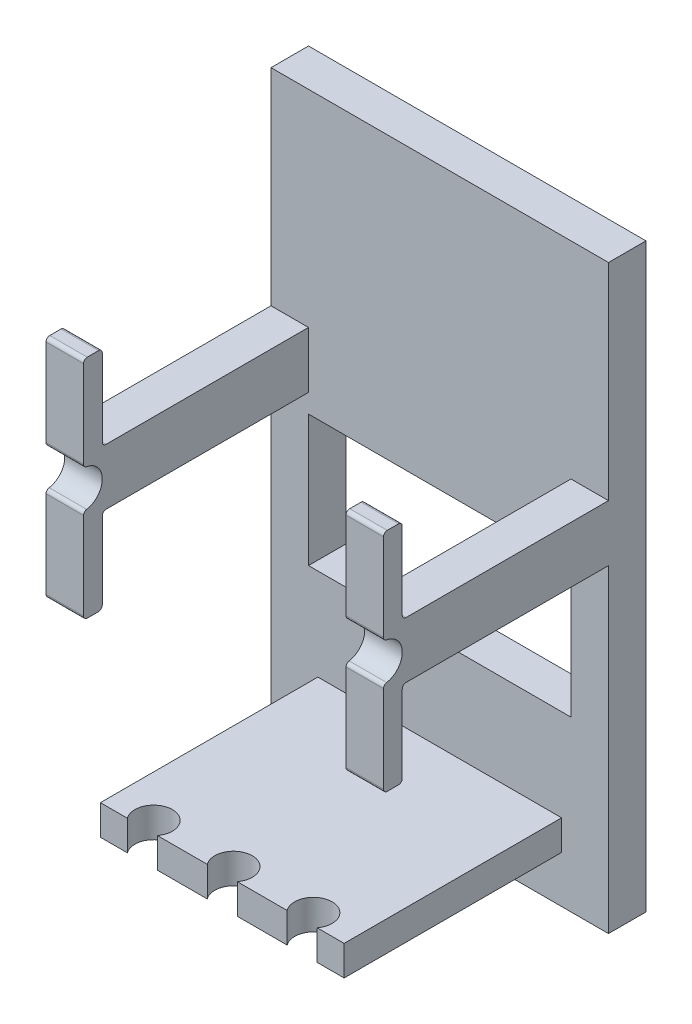
from build123d import *

# Parameters (mm, degrees)
SKETCH1_W               = 125
SKETCH1_H               = 90
BOSS_EXTRUDE1_DEPTH     = 10
BOSS_EXTRUDE2_DEPTH     = 35
BOSS_EXTRUDE3_DEPTH     = 45
SKETCH11_W              = 90
SKETCH11_H              = 30
BOSS_EXTRUDE5_DEPTH     = 10
CUT_EXTRUDE2_DEPTH      = 126
CUT_EXTRUDE2_DEPTH_BACK = 126
SKETCH7_W               = 35
SKETCH7_H               = 43
SKETCH7_H_2             = 6
SKETCH7_H_3             = 1
SKETCH17_W              = 60.575148418
SKETCH17_H              = 1.596164387
SKETCH17_W_2            = 94.424851582
BOSS_EXTRUDE7_DEPTH     = 90
SKETCH18_W              = 155
SKETCH18_H              = 8.403835613
BOSS_EXTRUDE8_DEPTH     = 90
CUT_EXTRUDE3_DEPTH      = 143.324453275
CUT_EXTRUDE3_DEPTH_BACK = 143.324453275
CUT_EXTRUDE4_DEPTH      = 126
CUT_EXTRUDE4_DEPTH_BACK = 126
SKETCH21_W              = 70
SKETCH21_H              = 10
CUT_EXTRUDE5_DEPTH      = 120.085053638
CUT_EXTRUDE5_DEPTH_BACK = 120.085053638
SKETCH22_W              = 70
SKETCH22_H              = 35
SKETCH23_W              = 65
SKETCH23_H              = 8
BOSS_EXTRUDE9_DEPTH     = 58
SKETCH24_R              = 5
CUT_EXTRUDE6_DEPTH      = 29


with BuildPart() as part:
    # Sketch1 → Boss-Extrude1 (new body)
    with BuildSketch(Plane(origin=(0, 0, 0), x_dir=(0, 1, 0), z_dir=(0, 0, 1))):
        Rectangle(SKETCH1_W, SKETCH1_H)
    extrude(amount=BOSS_EXTRUDE1_DEPTH)

    # Sketch3 → Boss-Extrude2 (add, symmetric)
    with BuildSketch(Plane.YZ):
        with BuildLine():
            Line((5.916079783, 60), (7.5, 60))
            Line((7.5, 60), (29.144025452, 60))
            ThreePointArc((29.144025452, 60), (29.851132233, 59.707106781), (30.144025452, 59))
            Line((30.144025452, 59), (30.144025452, 56))
            ThreePointArc((30.144025452, 56), (29.851132233, 55.292893219), (29.144025452, 55))
            Line((29.144025452, 55), (8.5, 55))
            ThreePointArc((8.5, 55), (7.792893219, 54.707106781), (7.5, 54))
            Line((7.5, 54), (7.5, 0))
            Line((7.5, 0), (-7.5, 0))
            Line((-7.5, 0), (-7.5, 54))
            ThreePointArc((-7.5, 54), (-7.792893219, 54.707106781), (-8.5, 55))
            Line((-8.5, 55), (-29.144025452, 55))
            ThreePointArc((-29.144025452, 55), (-29.851132233, 55.292893219), (-30.144025452, 56))
            Line((-30.144025452, 56), (-30.144025452, 59))
            ThreePointArc((-30.144025452, 59), (-29.851132233, 59.707106781), (-29.144025452, 60))
            Line((-29.144025452, 60), (-7.5, 60))
            Line((-7.5, 60), (-5.916079783, 60))
            ThreePointArc((-5.916079783, 60), (-5.270582559, 59.763762616), (-4.930066486, 59.166666667))
            ThreePointArc((-4.930066486, 59.166666667), (0, 55), (4.930066486, 59.166666667))
            ThreePointArc((4.930066486, 59.166666667), (5.270582559, 59.763762616), (5.916079783, 60))
        make_face()
    extrude(amount=BOSS_EXTRUDE2_DEPTH, both=True)

    # Sketch5 → Boss-Extrude3 (add, symmetric)
    with BuildSketch(Plane.YZ):
        with BuildLine():
            ThreePointArc((-7.5, 54), (-7.792893219, 54.707106781), (-8.5, 55))
            Line((-8.5, 55), (-29.144025452, 55))
            ThreePointArc((-29.144025452, 55), (-29.851132233, 55.292893219), (-30.144025452, 56))
            Line((-30.144025452, 56), (-30.144025452, 59))
            ThreePointArc((-30.144025452, 59), (-29.851132233, 59.707106781), (-29.144025452, 60))
            Line((-29.144025452, 60), (-5.916079783, 60))
            ThreePointArc((-5.916079783, 60), (-5.270582559, 59.763762616), (-4.930066486, 59.166666667))
            ThreePointArc((-4.930066486, 59.166666667), (0, 55), (4.930066486, 59.166666667))
            ThreePointArc((4.930066486, 59.166666667), (5.270582559, 59.763762616), (5.916079783, 60))
            Line((5.916079783, 60), (29.144025452, 60))
            ThreePointArc((29.144025452, 60), (29.851132233, 59.707106781), (30.144025452, 59))
            Line((30.144025452, 59), (30.144025452, 56))
            ThreePointArc((30.144025452, 56), (29.851132233, 55.292893219), (29.144025452, 55))
            Line((29.144025452, 55), (8.5, 55))
            ThreePointArc((8.5, 55), (7.792893219, 54.707106781), (7.5, 54))
            Line((7.5, 54), (7.5, 11))
            ThreePointArc((7.5, 11), (7.792893219, 10.292893219), (8.5, 10))
            Line((8.5, 10), (-8.5, 10))
            ThreePointArc((-8.5, 10), (-7.792893219, 10.292893219), (-7.5, 11))
            Line((-7.5, 11), (-7.5, 54))
        make_face()
    extrude(amount=BOSS_EXTRUDE3_DEPTH, both=True)

    # Sketch11 → Boss-Extrude5 (add)
    with BuildSketch(Plane.XY.offset(10)):
        with Locations((0, -77.5)):
            Rectangle(SKETCH11_W, SKETCH11_H)
    extrude(amount=-BOSS_EXTRUDE5_DEPTH)

    # Sketch7 → Cut-Extrude2 (cut, two sides: drawn at the far end of the back side and taken through both)
    with BuildSketch(Plane(origin=(0, 7.5, 0), x_dir=(-1, 0, 0), z_dir=(0, 1, 0)).offset(-CUT_EXTRUDE2_DEPTH_BACK)):
        with Locations((-17.5, 32.5)):
            Rectangle(SKETCH7_W, SKETCH7_H)
        Polygon((0, 54), (0, 11), (35, 11), (35, 35), (35, 54), align=None)
        with Locations((17.5, 57)):
            Rectangle(SKETCH7_W, SKETCH7_H_2)
        with Locations((-17.5, 57)):
            Rectangle(SKETCH7_W, SKETCH7_H_2)
        with Locations((-17.5, 10.5)):
            Rectangle(SKETCH7_W, SKETCH7_H_3)
        with Locations((17.5, 10.5)):
            Rectangle(SKETCH7_W, SKETCH7_H_3)
    extrude(amount=CUT_EXTRUDE2_DEPTH + CUT_EXTRUDE2_DEPTH_BACK, mode=Mode.SUBTRACT)

    # Sketch17 → Boss-Extrude7 (add)
    with BuildSketch(Plane.YZ.offset(45)):
        with Locations((-62.212425791, -0.798082194)):
            Rectangle(SKETCH17_W, SKETCH17_H)
        with Locations((15.287574209, -0.798082194)):
            Rectangle(SKETCH17_W_2, SKETCH17_H)
    extrude(amount=-BOSS_EXTRUDE7_DEPTH)

    # Sketch18 → Boss-Extrude8 (add)
    with BuildSketch(Plane.YZ.offset(45)):
        with Locations((-15, -5.798082193)):
            Rectangle(SKETCH18_W, SKETCH18_H)
    extrude(amount=-BOSS_EXTRUDE8_DEPTH)

    # Sketch19 → Cut-Extrude3 (cut, two sides: drawn at the far end of the back side and taken through both)
    with BuildSketch(Plane.YZ.offset(45).offset(-CUT_EXTRUDE3_DEPTH_BACK)):
        with BuildLine():
            Line((-92.5, 10), (-8.5, 10))
            ThreePointArc((-8.5, 10), (-7.792893219, 10.292893219), (-7.5, 11))
            Line((-7.5, 11), (-7.5, 0))
            Line((-7.5, 0), (-92.5, 0))
            Line((-92.5, 0), (-92.5, 10))
        make_face()
        with BuildLine():
            Line((62.5, 10), (62.5, 0))
            Line((62.5, 0), (7.5, 0))
            Line((7.5, 0), (7.5, 11))
            ThreePointArc((7.5, 11), (7.792893219, 10.292893219), (8.5, 10))
            Line((8.5, 10), (62.5, 10))
        make_face()
    extrude(amount=CUT_EXTRUDE3_DEPTH + CUT_EXTRUDE3_DEPTH_BACK, mode=Mode.SUBTRACT)

    # Sketch21 → Cut-Extrude4 (cut, two sides: drawn at the far end of the back side and taken through both)
    with BuildSketch(Plane(origin=(0, 7.5, 0), x_dir=(-1, 0, 0), z_dir=(0, 1, 0)).offset(-CUT_EXTRUDE4_DEPTH_BACK)):
        with Locations((0, 5)):
            Rectangle(SKETCH21_W, SKETCH21_H)
    extrude(amount=CUT_EXTRUDE4_DEPTH + CUT_EXTRUDE4_DEPTH_BACK, mode=Mode.SUBTRACT)

    # Sketch22 → Cut-Extrude5 (cut, two sides: drawn at the far end of the back side and taken through both)
    with BuildSketch(Plane.XY.offset(-CUT_EXTRUDE5_DEPTH_BACK)):
        with Locations((0, -30)):
            Rectangle(SKETCH22_W, SKETCH22_H)
    extrude(amount=CUT_EXTRUDE5_DEPTH + CUT_EXTRUDE5_DEPTH_BACK, mode=Mode.SUBTRACT)

    # Sketch23 → Boss-Extrude9 (add)
    with BuildSketch(Plane.XY):
        with Locations((0, -76)):
            Rectangle(SKETCH23_W, SKETCH23_H)
    extrude(amount=BOSS_EXTRUDE9_DEPTH)

    # Sketch24 → Cut-Extrude6 (cut, symmetric)
    with BuildSketch(Plane.XZ.offset(80)):
        with Locations((0, 55)):
            Circle(SKETCH24_R)
        with Locations((-21.3, 55)):
            Circle(SKETCH24_R)
        with Locations((21.3, 55)):
            Circle(SKETCH24_R)
    extrude(amount=CUT_EXTRUDE6_DEPTH, both=True, mode=Mode.SUBTRACT)


solid = part.part
